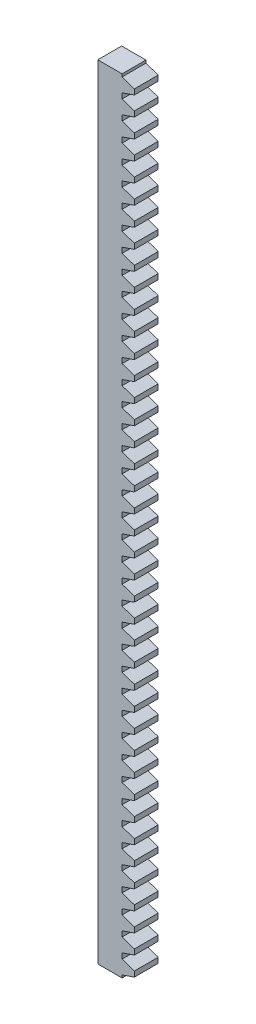
from build123d import *

# Parameters (mm, degrees)
RESSALTO_EXTRUS_O1_DEPTH = 5
SCALE2_SCALE             = 0.487804878


with BuildPart() as part:
    # Esboço1 → Ressalto-extrusão1 (new, symmetric)
    with BuildSketch(Plane.XY):
        Polygon((-2.596479089, -162.874745928), (2.546479089, -161.115750635), (2.546479089, -158.884249365), (-2.596479089, -157.125254072), (-2.596479089, -154.874745928), (2.546479089, -153.115750635), (2.546479089, -150.884249365), (-2.596479089, -149.125254072), (-2.596479089, -146.874745928), (2.546479089, -145.115750635), (2.546479089, -142.884249365), (-2.596479089, -141.125254072), (-2.596479089, -138.874745928), (2.546479089, -137.115750635), (2.546479089, -134.884249365), (-2.596479089, -133.125254072), (-2.596479089, -130.874745928), (2.546479089, -129.115750635), (2.546479089, -126.884249365), (-2.596479089, -125.125254072), (-2.596479089, -122.874745928), (2.546479089, -121.115750635), (2.546479089, -118.884249365), (-2.596479089, -117.125254072), (-2.596479089, -114.874745928), (2.546479089, -113.115750635), (2.546479089, -110.884249365), (-2.596479089, -109.125254072), (-2.596479089, -106.874745928), (2.546479089, -105.115750635), (2.546479089, -102.884249365), (-2.596479089, -101.125254072), (-2.596479089, -98.874745928), (2.546479089, -97.115750635), (2.546479089, -94.884249365), (-2.596479089, -93.125254072), (-2.596479089, -90.874745928), (2.546479089, -89.115750635), (2.546479089, -86.884249365), (-2.596479089, -85.125254072), (-2.596479089, -82.874745928), (2.546479089, -81.115750635), (2.546479089, -78.884249365), (-2.596479089, -77.125254072), (-2.596479089, -74.874745928), (2.546479089, -73.115750635), (2.546479089, -70.884249365), (-2.596479089, -69.125254072), (-2.596479089, -66.874745928), (2.546479089, -65.115750635), (2.546479089, -62.884249365), (-2.596479089, -61.125254072), (-2.596479089, -58.874745928), (2.546479089, -57.115750635), (2.546479089, -54.884249365), (-2.596479089, -53.125254072), (-2.596479089, -50.874745928), (2.546479089, -49.115750635), (2.546479089, -46.884249365), (-2.596479089, -45.125254072), (-2.596479089, -42.874745928), (2.546479089, -41.115750635), (2.546479089, -38.884249365), (-2.596479089, -37.125254072), (-2.596479089, -34.874745928), (2.546479089, -33.115750635), (2.546479089, -30.884249365), (-2.596479089, -29.125254072), (-2.596479089, -26.874745928), (2.546479089, -25.115750635), (2.546479089, -22.884249365), (-2.596479089, -21.125254072), (-2.596479089, -18.874745928), (2.546479089, -17.115750635), (2.546479089, -14.884249365), (-2.596479089, -13.125254072), (-2.596479089, -10.874745928), (2.546479089, -9.115750635), (2.546479089, -6.884249365), (-2.596479089, -5.125254072), (-2.596479089, -2.874745928), (2.546479089, -1.115750635), (2.546479089, 1.115750635), (-2.596479089, 2.874745928), (-2.596479089, 5.125254072), (2.546479089, 6.884249365), (2.546479089, 9.115750635), (-2.596479089, 10.874745928), (-2.596479089, 13.125254072), (2.546479089, 14.884249365), (2.546479089, 17.115750635), (-2.596479089, 18.874745928), (-2.596479089, 21.125254072), (2.546479089, 22.884249365), (2.546479089, 25.115750635), (-2.596479089, 26.874745928), (-2.596479089, 29.125254072), (2.546479089, 30.884249365), (2.546479089, 33.115750635), (-2.596479089, 34.874745928), (-2.596479089, 37.125254072), (2.546479089, 38.884249365), (2.546479089, 41.115750635), (-2.596479089, 42.874745928), (-2.596479089, 45.125254072), (2.546479089, 46.884249365), (2.546479089, 49.115750635), (-2.596479089, 50.874745928), (-2.596479089, 53.125254072), (2.546479089, 54.884249365), (2.546479089, 57.115750635), (-2.596479089, 58.874745928), (-2.596479089, 61.125254072), (2.546479089, 62.884249365), (2.546479089, 65.115750635), (-2.596479089, 66.874745928), (-2.596479089, 69.125254072), (2.546479089, 70.884249365), (2.546479089, 73.115750635), (-2.596479089, 74.874745928), (-2.596479089, 77.125254072), (2.546479089, 78.884249365), (2.546479089, 81.115750635), (-2.596479089, 82.874745928), (-2.596479089, 85.125254072), (2.546479089, 86.884249365), (2.546479089, 89.115750635), (-2.596479089, 90.874745928), (-2.596479089, 93.125254072), (2.546479089, 94.884249365), (2.546479089, 97.115750635), (-2.596479089, 98.874745928), (-2.596479089, 101.125254072), (2.546479089, 102.884249365), (2.546479089, 105.115750635), (-2.596479089, 106.874745928), (-2.596479089, 109.125254072), (2.546479089, 110.884249365), (2.546479089, 113.115750635), (-2.596479089, 114.874745928), (-2.596479089, 117.125254072), (2.546479089, 118.884249365), (2.546479089, 121.115750635), (-2.596479089, 122.874745928), (-2.596479089, 125.125254072), (2.546479089, 126.884249365), (2.546479089, 129.115750635), (-2.596479089, 130.874745928), (-2.596479089, 133.125254072), (2.546479089, 134.884249365), (2.546479089, 137.115750635), (-2.596479089, 138.874745928), (-2.596479089, 141.125254072), (2.546479089, 142.884249365), (2.546479089, 145.115750635), (-2.596479089, 146.874745928), (-2.596479089, 149.125254072), (2.546479089, 150.884249365), (2.546479089, 153.115750635), (-2.596479089, 154.874745928), (-2.596479089, 157.125254072), (2.546479089, 158.884249365), (2.546479089, 161.115750635), (-2.596479089, 162.874745928), (-2.596479089, 164), (-12.782395447, 164), (-12.782395447, -164), (-2.596479089, -164), align=None)
    extrude(amount=RESSALTO_EXTRUS_O1_DEPTH, both=True)


with BuildPart() as part_1:
    # Scale2: scaled about (-6.22348049, 0, 0)
    add(part.part.scale(SCALE2_SCALE).moved(Location((-3.187636349, 0, 0))))


solid = part_1.part
